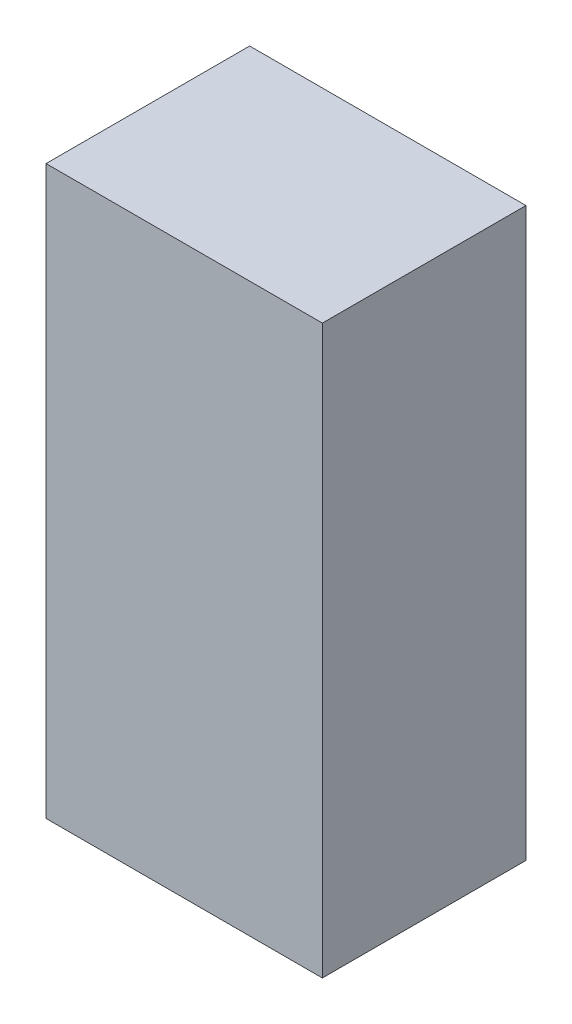
from build123d import *

# Parameters (mm, degrees)
SKETCH_1_W      = 38
SKETCH_1_H      = 78
EXTRUDE_1_DEPTH = 28


with BuildPart() as part:
    # 草图1 → 凸台-拉伸1 (new body)
    with BuildSketch(Plane.XY):
        Rectangle(SKETCH_1_W, SKETCH_1_H)
    extrude(amount=-EXTRUDE_1_DEPTH)


solid = part.part
